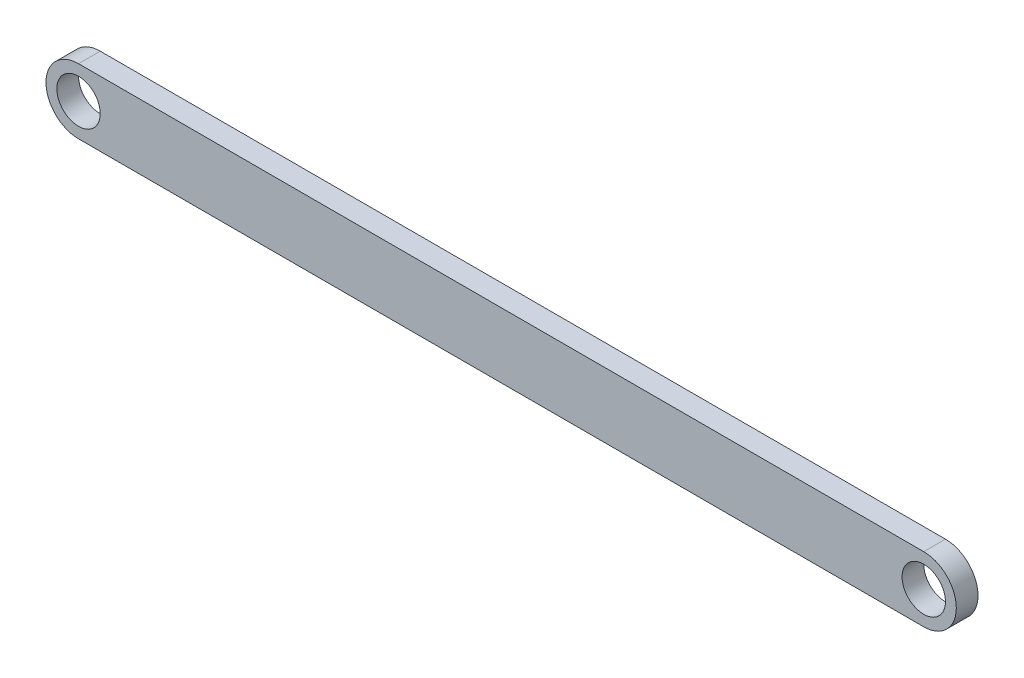
from build123d import *

# Parameters (mm, degrees)
SKETCH1_R           = 1
BOSS_EXTRUDE1_DEPTH = 0.5


with BuildPart() as part:
    # Sketch1 → Boss-Extrude1 (new, symmetric)
    with BuildSketch(Plane.XY):
        with BuildLine():
            Line((0, -1.5), (-38.95, -1.5))
            ThreePointArc((-38.95, -1.5), (-40.45, 0), (-38.95, 1.5))
            Line((-38.95, 1.5), (0, 1.5))
            ThreePointArc((0, 1.5), (1.5, 0), (0, -1.5))
        make_face()
        with Locations((-38.95, 0)):
            Circle(SKETCH1_R, mode=Mode.SUBTRACT)
        Circle(SKETCH1_R, mode=Mode.SUBTRACT)
    extrude(amount=BOSS_EXTRUDE1_DEPTH, both=True)


solid = part.part
